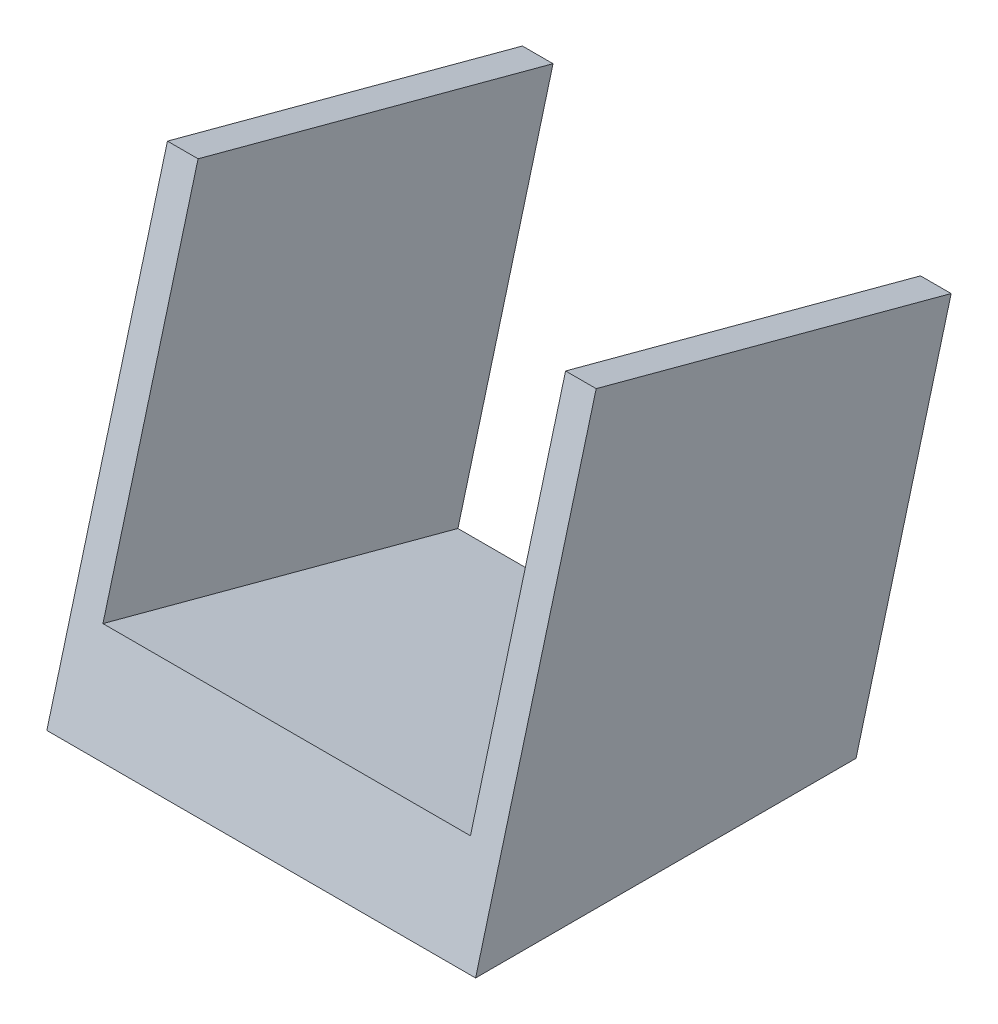
from build123d import *

# Parameters (mm, degrees)
BOSS_EXTRUDE1_DEPTH = 44.45
CUT_EXTRUDE1_DEPTH  = 38.1


with BuildPart() as part:
    # Sketch1 → Boss-Extrude1 (new, symmetric)
    with BuildSketch(Plane(origin=(0, 0, 0), x_dir=(0, 0, -1), z_dir=(1, 0, 0))):
        Polygon((-39.444022474, 0), (39.444022474, 0), (59.16603371, 73.603547963), (-14.437514253, 93.3255592), align=None)
    extrude(amount=BOSS_EXTRUDE1_DEPTH, both=True)

    # Sketch2 → Cut-Extrude1 (cut, symmetric)
    with BuildSketch(Plane(origin=(0, 0, 0), x_dir=(0, 0, -1), z_dir=(1, 0, 0))):
        Polygon((-34.15952549, 19.722011237), (-14.437514253, 93.3255592), (59.16603371, 73.603547963), (39.444022474, 0), align=None)
    extrude(amount=CUT_EXTRUDE1_DEPTH, both=True, mode=Mode.SUBTRACT)


solid = part.part
